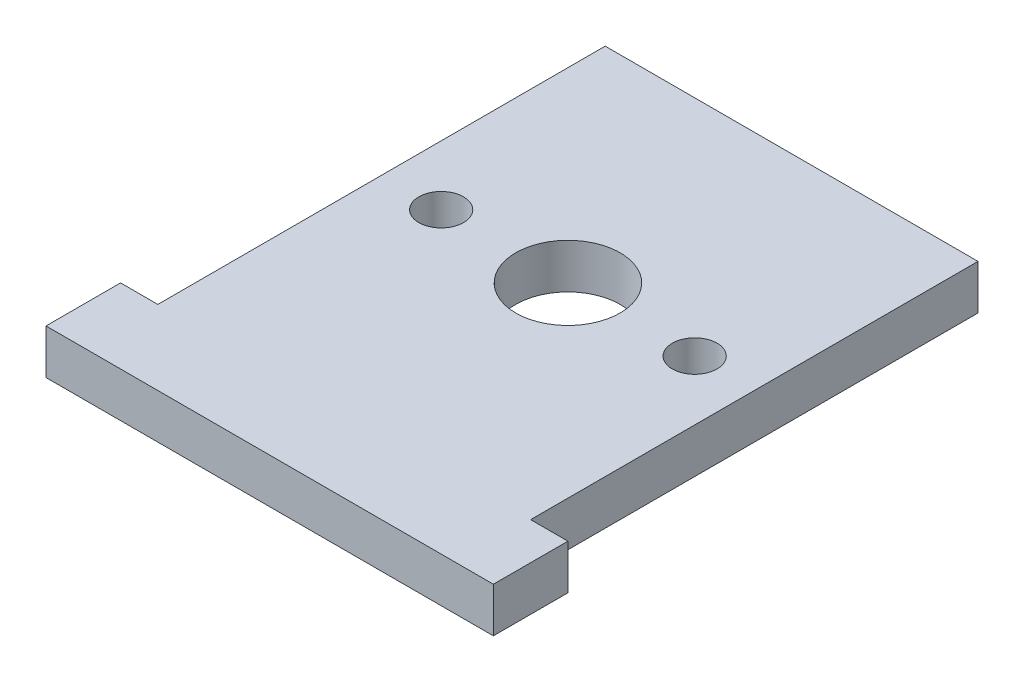
from build123d import *

# Parameters (mm, degrees)
SKETCH1_W           = 25
SKETCH1_H           = 30
SKETCH1_R           = 1.5
SKETCH1_R_2         = 3.5
SKETCH1_W_2         = 30
SKETCH1_H_2         = 5
BOSS_EXTRUDE4_DEPTH = 3


with BuildPart() as part:
    # Sketch1 → Boss-Extrude4 (new body)
    # profile 1 of 2: a face of its own
    with BuildSketch(Plane(origin=(0, 0, 0), x_dir=(1, 0, 0), z_dir=(0, 1, 0))):
        with Locations((-26.523048167, -1.727371577)):
            Rectangle(SKETCH1_W, SKETCH1_H)
        with Locations(Location((-18.023048167, -1.727371577, 0), (0, 0, 270))):
            Circle(SKETCH1_R, mode=Mode.SUBTRACT)
        with Locations(Location((-26.523048167, -1.727371577, 0), (0, 0, 270))):
            Circle(SKETCH1_R_2, mode=Mode.SUBTRACT)
        with Locations(Location((-35.023048167, -1.727371577, 0), (0, 0, 270))):
            Circle(SKETCH1_R, mode=Mode.SUBTRACT)
    # profile 2 of 2: a face of its own
    with BuildSketch(Plane(origin=(0, 0, 0), x_dir=(1, 0, 0), z_dir=(0, 1, 0))):
        with Locations((-26.523048167, -19.227371577)):
            Rectangle(SKETCH1_W_2, SKETCH1_H_2)
    extrude(amount=BOSS_EXTRUDE4_DEPTH)


solid = part.part
